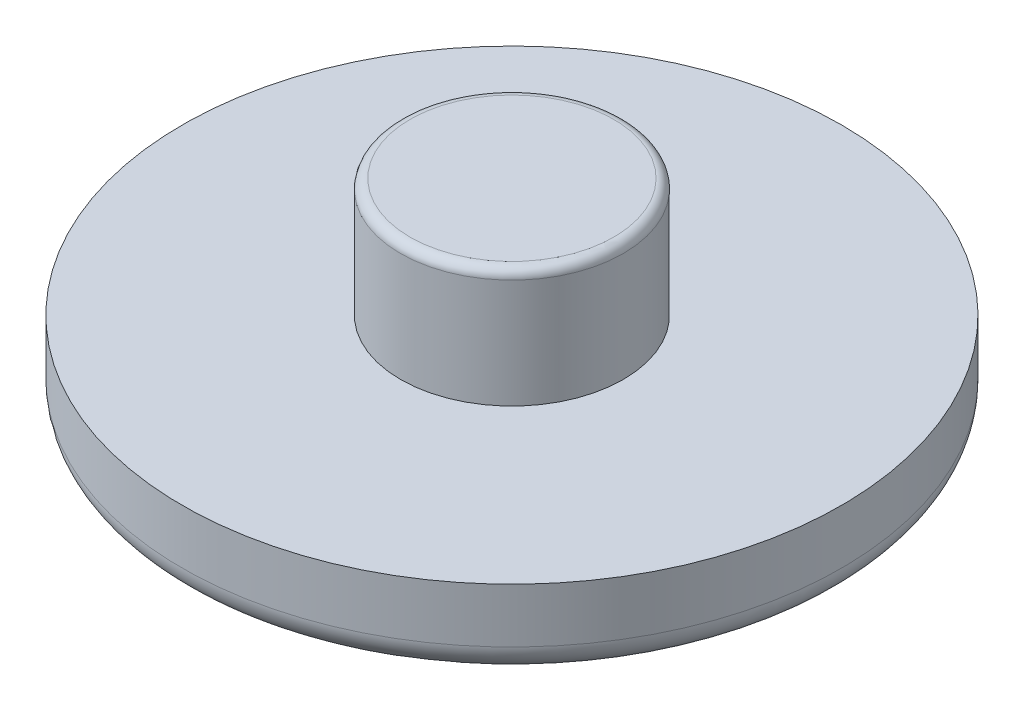
from build123d import *

# Parameters (mm, degrees)
SKETCH1_R           = 17.653
BOSS_EXTRUDE1_DEPTH = 7.62
SKETCH2_R           = 5.969
BOSS_EXTRUDE2_DEPTH = 6.35
CHAMFER1_SIZE       = 10
CHAMFER1_SIZE2      = 3.639702343
FILLET1_R           = 1.524
FILLET2_R           = 0.508


with BuildPart() as part:
    # Sketch1 → Boss-Extrude1 (new body)
    with BuildSketch(Plane(origin=(0, 0, 0), x_dir=(1, 0, 0), z_dir=(0, 1, 0))):
        with Locations(Location((0, 0, 0), (0, 0, 90))):
            Circle(SKETCH1_R)
    extrude(amount=BOSS_EXTRUDE1_DEPTH)

    # Sketch2 → Boss-Extrude2 (add)
    with BuildSketch(Plane(origin=(0, 7.62, 0), x_dir=(1, 0, 0), z_dir=(0, 1, 0))):
        with Locations(Location((0, 0, 0), (0, 0, 270))):
            Circle(SKETCH2_R)
    extrude(amount=BOSS_EXTRUDE2_DEPTH)

    # Chamfer1
    chamfer1_edges = [part.edges().sort_by_distance(p)[0] for p in [
        (0, 0, 17.653),
    ]]
    chamfer1_side = [part.faces().sort_by_distance(p)[0] for p in [
        (0, 0, 0),
    ]]
    chamfer(chamfer1_edges, length=CHAMFER1_SIZE, length2=CHAMFER1_SIZE2, reference=chamfer1_side[0])

    # Fillet1
    fillet1_edges = [part.edges().sort_by_distance(p)[0] for p in [
        (0, 0, 7.653),
        (0, 3.639702343, 17.653),
    ]]
    fillet(fillet1_edges, radius=FILLET1_R)

    # Fillet2
    fillet2_edges = [part.edges().sort_by_distance(p)[0] for p in [
        (0, 13.97, -5.969),
    ]]
    fillet(fillet2_edges, radius=FILLET2_R)


solid = part.part
